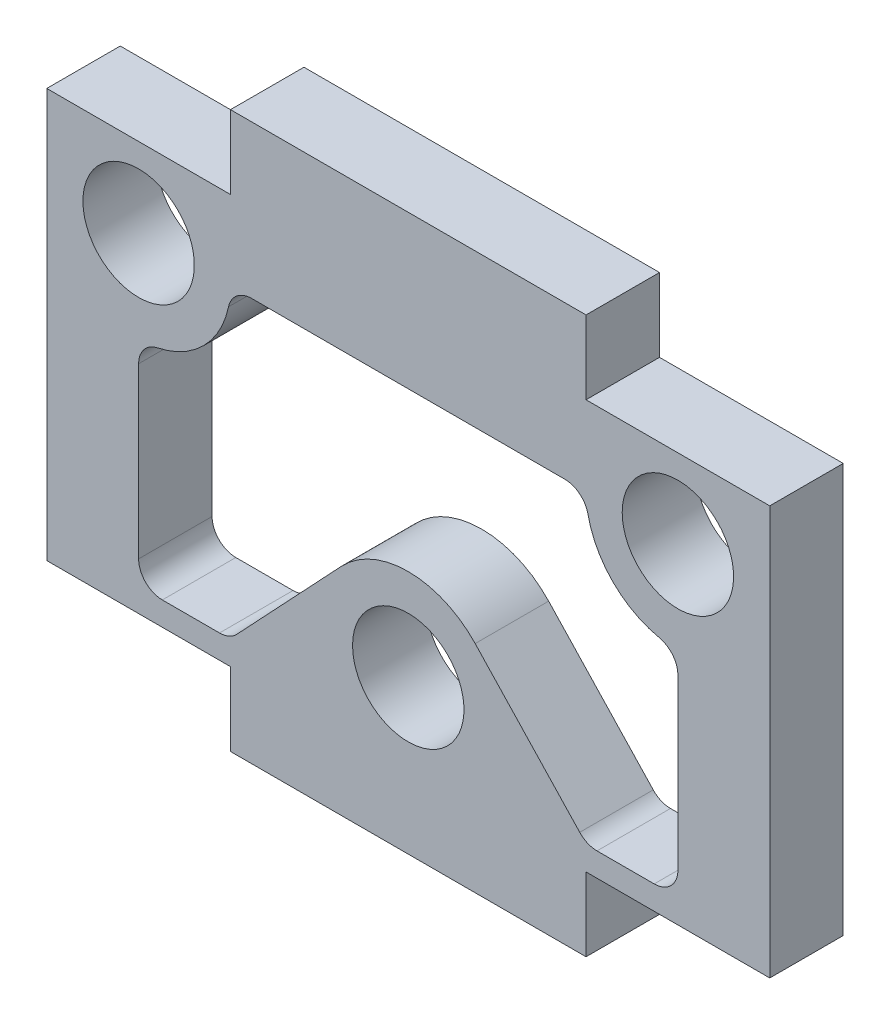
from build123d import *

# Parameters (mm, degrees)
SKETCH1_R      = 2.35
EXTRUDE1_DEPTH = 3.1


with BuildPart() as part:
    # Sketch1 → Extrude1 (new body)
    with BuildSketch(Plane.XY):
        Polygon((-33.263157114, 29.408489293), (-41.013157114, 29.408489293), (-41.013157114, 12.158489293), (-33.263157114, 12.158489293), (-33.263157114, 9.058489293), (-18.263157114, 9.058489293), (-18.263157114, 12.158489293), (-10.513157114, 12.158489293), (-10.513157114, 29.408489293), (-18.263157114, 29.408489293), (-18.263157114, 32.508489293), (-33.263157114, 32.508489293), align=None)
        with Locations(Location((-14.388157114, 26.058489293, 0), (0, 0, 180))):
            Circle(SKETCH1_R, mode=Mode.SUBTRACT)
        with Locations(Location((-37.138157114, 26.058489293, 0), (0, 0, 180))):
            Circle(SKETCH1_R, mode=Mode.SUBTRACT)
        with Locations(Location((-25.763157114, 15.508489293, 0), (0, 0, 180))):
            Circle(SKETCH1_R, mode=Mode.SUBTRACT)
        with BuildLine():
            Line((-37.138157114, 21.287155622), (-37.138157114, 14.158489293))
            ThreePointArc((-37.138157114, 14.158489293), (-36.845263895, 13.451382512), (-36.138157114, 13.158489293))
            Line((-36.138157114, 13.158489293), (-33.725119975, 13.158489293))
            ThreePointArc((-33.725119975, 13.158489293), (-33.328320215, 13.240584097), (-32.996670851, 13.473389392))
            Line((-32.996670851, 13.473389392), (-28.585897467, 18.16325141))
            ThreePointArc((-28.585897467, 18.16325141), (-25.763157114, 19.383489293), (-22.940416761, 18.16325141))
            Line((-22.940416761, 18.16325141), (-18.529643377, 13.473389392))
            ThreePointArc((-18.529643377, 13.473389392), (-18.197994013, 13.240584097), (-17.801194253, 13.158489293))
            Line((-17.801194253, 13.158489293), (-15.388157114, 13.158489293))
            ThreePointArc((-15.388157114, 13.158489293), (-14.681050333, 13.451382512), (-14.388157114, 14.158489293))
            Line((-14.388157114, 14.158489293), (-14.388157114, 21.287155622))
            ThreePointArc((-14.388157114, 21.287155622), (-14.611907088, 21.917580794), (-15.183028909, 22.265890734))
            ThreePointArc((-15.183028909, 22.265890734), (-17.128195891, 23.318450516), (-18.180755673, 25.263617499))
            ThreePointArc((-18.180755673, 25.263617499), (-18.529065613, 25.834739319), (-19.159490785, 26.058489293))
            Line((-19.159490785, 26.058489293), (-32.366823443, 26.058489293))
            ThreePointArc((-32.366823443, 26.058489293), (-32.997248615, 25.834739319), (-33.345558555, 25.263617499))
            ThreePointArc((-33.345558555, 25.263617499), (-34.398118337, 23.318450516), (-36.343285319, 22.265890734))
            ThreePointArc((-36.343285319, 22.265890734), (-36.91440714, 21.917580794), (-37.138157114, 21.287155622))
        make_face(mode=Mode.SUBTRACT)
    extrude(amount=EXTRUDE1_DEPTH)


solid = part.part
